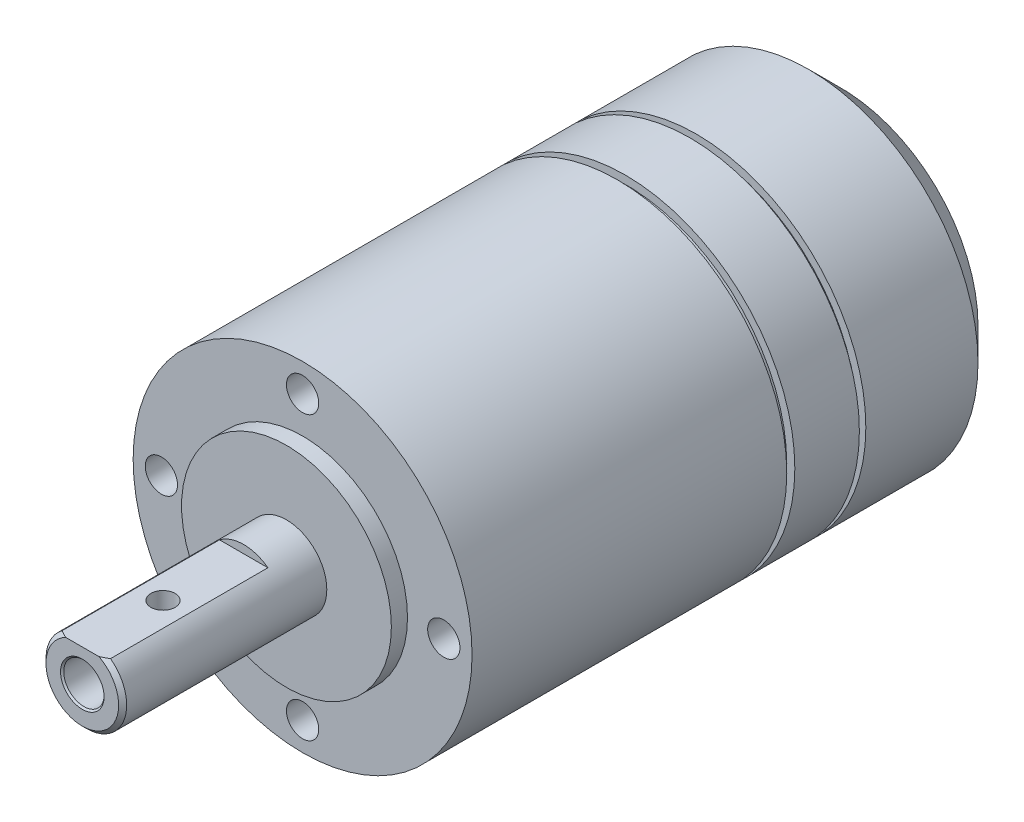
from build123d import *

# Parameters (mm, degrees)
SKETCH_1_R           = 21
EXTRUDE_1_DEPTH      = 39
SKETCH_2_R           = 13
EXTRUDE_2_DEPTH      = 2
SKETCH_4_R           = 5
EXTRUDE_3_DEPTH      = 25.3
CHAMFER_1_SIZE       = 0.5
SKETCH_8_R           = 1.5
CUT_EXTRUDE_7_DEPTH  = 10.3
MM_2_D               = 5
MM_2_DEPTH           = 10
MM_2_TIP             = 1.502151548
CUT_EXTRUDE_8_DEPTH  = 2
MM_1_D               = 4
MM_1_DEPTH           = 10
MM_1_TIP             = 1.201721238
SKETCH_23_W          = 4
SKETCH_23_H          = 0.5
CUT_EXTRUDE_12_DEPTH = 2
SKETCH_24_R          = 20
EXTRUDE_4_DEPTH      = 1
EXTRUDE_START        = 8
SKETCH_26_R          = 21
EXTRUDE_5_DEPTH      = 8
SKETCH_27_R          = 20
EXTRUDE_6_DEPTH      = 0.8
EXTRUDE_START_2      = 17.9
SKETCH_28_R          = 21
EXTRUDE_7_DEPTH      = 17.9
CHAMFER_2_SIZE       = 4
SKETCH_29_R          = 4
EXTRUDE_8_DEPTH      = 4.4
CUT_EXTRUDE_16_DEPTH = 2
CHAMFER_3_SIZE       = 0.2


with BuildPart() as part:
    # 草图1 → 凸台-拉伸1 (new body)
    with BuildSketch(Plane.XY):
        Circle(SKETCH_1_R)
    extrude(amount=EXTRUDE_1_DEPTH)

    # 草图2 → 凸台-拉伸2 (add)
    with BuildSketch(Plane.XY.offset(39)):
        Circle(SKETCH_2_R)
    extrude(amount=EXTRUDE_2_DEPTH)

    # 草图4 → 凸台-拉伸3 (add)
    with BuildSketch(Plane.XY.offset(41)):
        Circle(SKETCH_4_R)
    extrude(amount=EXTRUDE_3_DEPTH)

    # 倒角1
    chamfer_1_edges = [part.edges().sort_by_distance(p)[0] for p in [
        (-5, 0, 66.3),
    ]]
    chamfer(chamfer_1_edges, length=CHAMFER_1_SIZE)

    # 草图8 → 切除-拉伸7 (cut)
    with BuildSketch(Plane(origin=(0, -5, 0), x_dir=(1, 0, 0), z_dir=(0, 1, 0))):
        with Locations(Location((0, -56.3, 0), (0, 0, 90))):
            Circle(SKETCH_8_R)
    extrude(amount=CUT_EXTRUDE_7_DEPTH, mode=Mode.SUBTRACT)

    # 大小mm 暗销孔2
    with Locations(Plane.XY.offset(66.3)):
        with Locations((0, 0)):
            Hole(MM_2_D / 2, depth=MM_2_DEPTH)
            with Locations((0, 0, -(MM_2_DEPTH + MM_2_TIP / 2))):  # 118° drill point
                Cone(0, MM_2_D / 2, MM_2_TIP, mode=Mode.SUBTRACT)

    # 草图17 → 切除-拉伸8 (cut)
    with BuildSketch(Plane(origin=(0, 4, 0), x_dir=(1, 0, 0), z_dir=(0, 1, 0))):
        Polygon((0, -65.8), (-2, -65.8), (-2, -46.3), (0, -46.3), (2, -46.3), (2, -65.8), align=None)
    extrude(amount=CUT_EXTRUDE_8_DEPTH, mode=Mode.SUBTRACT)

    # 大小mm 暗销孔1
    with Locations(Plane(origin=(0, 17.5, 39), x_dir=(1, 0, 0), z_dir=(0, 0, 1))):
        with Locations((0, 0), (-17.5, -17.5), (17.5, -17.5), (0, -35)):
            Hole(MM_1_D / 2, depth=MM_1_DEPTH)
            with Locations((0, 0, -(MM_1_DEPTH + MM_1_TIP / 2))):  # 118° drill point
                Cone(0, MM_1_D / 2, MM_1_TIP, mode=Mode.SUBTRACT)

    # 草图23 → 切除-拉伸12 (cut)
    with BuildSketch(Plane(origin=(0, 4, 0), x_dir=(1, 0, 0), z_dir=(0, 1, 0))):
        with Locations((0, -66.05)):
            Rectangle(SKETCH_23_W, SKETCH_23_H)
    extrude(amount=CUT_EXTRUDE_12_DEPTH, mode=Mode.SUBTRACT)

    # 草图24 → 凸台-拉伸4 (add)
    with BuildSketch(Plane(origin=(0, 0, 0), x_dir=(-1, 0, 0), z_dir=(0, 0, -1))):
        with Locations(Location((0, 0, 0), (0, 0, 180))):
            Circle(SKETCH_24_R)
    extrude(amount=EXTRUDE_4_DEPTH)

    # 草图26 → 凸台-拉伸5 (add)
    with BuildSketch(Plane(origin=(0, 0, -1), x_dir=(-1, 0, 0), z_dir=(0, 0, -1)).offset(EXTRUDE_START)):
        with Locations(Location((0, 0, 0), (0, 0, 180))):
            Circle(SKETCH_26_R)
    extrude(amount=-EXTRUDE_5_DEPTH)

    # 草图27 → 凸台-拉伸6 (add)
    with BuildSketch(Plane(origin=(0, 0, -9), x_dir=(-1, 0, 0), z_dir=(0, 0, -1))):
        with Locations(Location((0, 0, 0), (0, 0, 180))):
            Circle(SKETCH_27_R)
    extrude(amount=EXTRUDE_6_DEPTH)

    # 草图28 → 凸台-拉伸7 (add)
    with BuildSketch(Plane(origin=(0, 0, -9.8), x_dir=(-1, 0, 0), z_dir=(0, 0, -1)).offset(EXTRUDE_START_2)):
        with Locations(Location((0, 0, 0), (0, 0, 180))):
            Circle(SKETCH_28_R)
    extrude(amount=-EXTRUDE_7_DEPTH)

    # 倒角2
    chamfer_2_edges = [part.edges().sort_by_distance(p)[0] for p in [
        (-21, 0, -27.7),
    ]]
    chamfer(chamfer_2_edges, length=CHAMFER_2_SIZE)

    # 草图29 → 凸台-拉伸8 (add)
    with BuildSketch(Plane(origin=(0, 0, -27.7), x_dir=(-1, 0, 0), z_dir=(0, 0, -1))):
        Circle(SKETCH_29_R)
    extrude(amount=EXTRUDE_8_DEPTH)

    # 草图30 → 切除-拉伸16 (cut)
    with BuildSketch(Plane(origin=(0, 4, 0), x_dir=(1, 0, 0), z_dir=(0, 1, 0))):
        Polygon((0, -46.3), (3, -46.3), (3, -66.3), (-3, -66.3), (-3, -46.3), align=None)
    extrude(amount=CUT_EXTRUDE_16_DEPTH, mode=Mode.SUBTRACT)

    # 倒角3
    chamfer_3_edges = [part.edges().sort_by_distance(p)[0] for p in [
        (2.5, 0, 66.3),
    ]]
    chamfer(chamfer_3_edges, length=CHAMFER_3_SIZE)


solid = part.part
